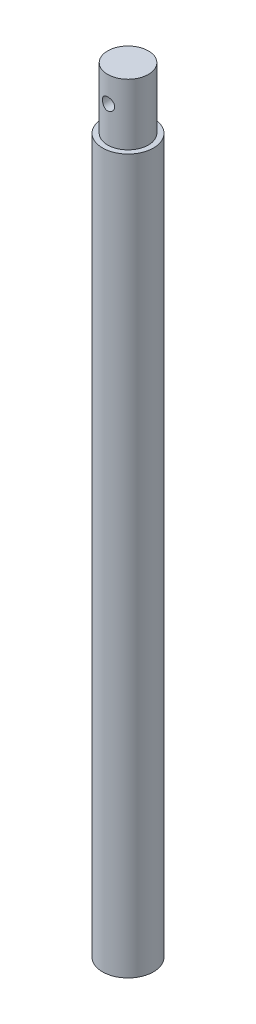
from build123d import *

# Parameters (mm, degrees)
SKETCH3_R          = 3
CUT_EXTRUDE1_DEPTH = 25


with BuildPart() as part:
    # Sketch2 → Revolve1 (revolve)
    with BuildSketch(Plane.XY, mode=Mode.PRIVATE) as revolve1_sk:
        Polygon((0, 0), (12.5, 0), (12.5, 350), (10, 350), (10, 380), (0, 380), align=None)
    revolve(revolve1_sk.sketch.rotate(Axis((0, 0, 0), (0, 1, 0)), 90), axis=Axis((0, 0, 0), (0, 1, 0)))

    # Sketch3 → Cut-Extrude1 (cut, symmetric)
    with BuildSketch(Plane.XY):
        with Locations((0, 367.5)):
            Circle(SKETCH3_R)
    extrude(amount=CUT_EXTRUDE1_DEPTH, both=True, mode=Mode.SUBTRACT)


solid = part.part
